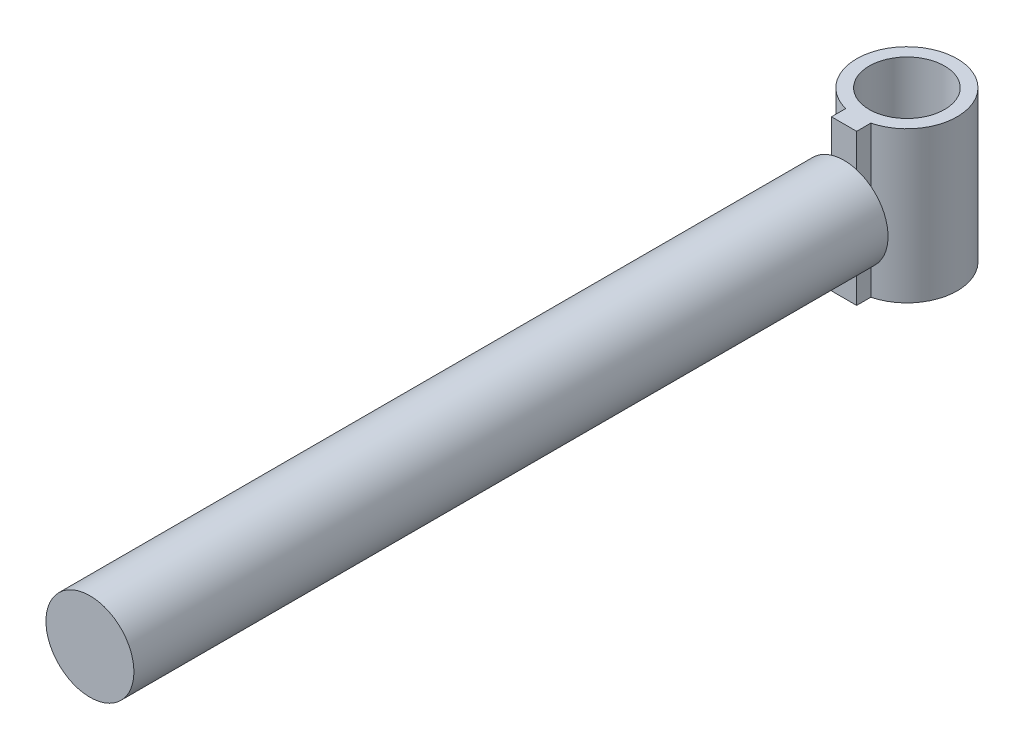
from build123d import *

# Parameters (mm, degrees)
IZIM1_R                     = 35
Y_KSEKLIK_EKSTR_ZYON1_DEPTH = 600
IZIM2_R                     = 30
Y_KSEKLIK_EKSTR_ZYON2_DEPTH = 60


with BuildPart() as part:
    # Çizim1 → Yükseklik-Ekstrüzyon1 (new body)
    with BuildSketch(Plane.XY):
        Circle(IZIM1_R)
    extrude(amount=Y_KSEKLIK_EKSTR_ZYON1_DEPTH)

    # Çizim2 → Yükseklik-Ekstrüzyon2 (add, symmetric)
    with BuildSketch(Plane(origin=(0, 0, 0), x_dir=(1, 0, 0), z_dir=(0, 1, 0))):
        with BuildLine():
            Line((10, 0), (10, 11.270166538))
            ThreePointArc((10, 11.270166538), (0, 90), (-10, 11.270166538))
            Line((-10, 11.270166538), (-10, 0))
            Line((-10, 0), (10, 0))
        make_face()
        with Locations(Location((0, 50, 0), (0, 0, 270))):
            Circle(IZIM2_R, mode=Mode.SUBTRACT)
    extrude(amount=Y_KSEKLIK_EKSTR_ZYON2_DEPTH, both=True)


solid = part.part
